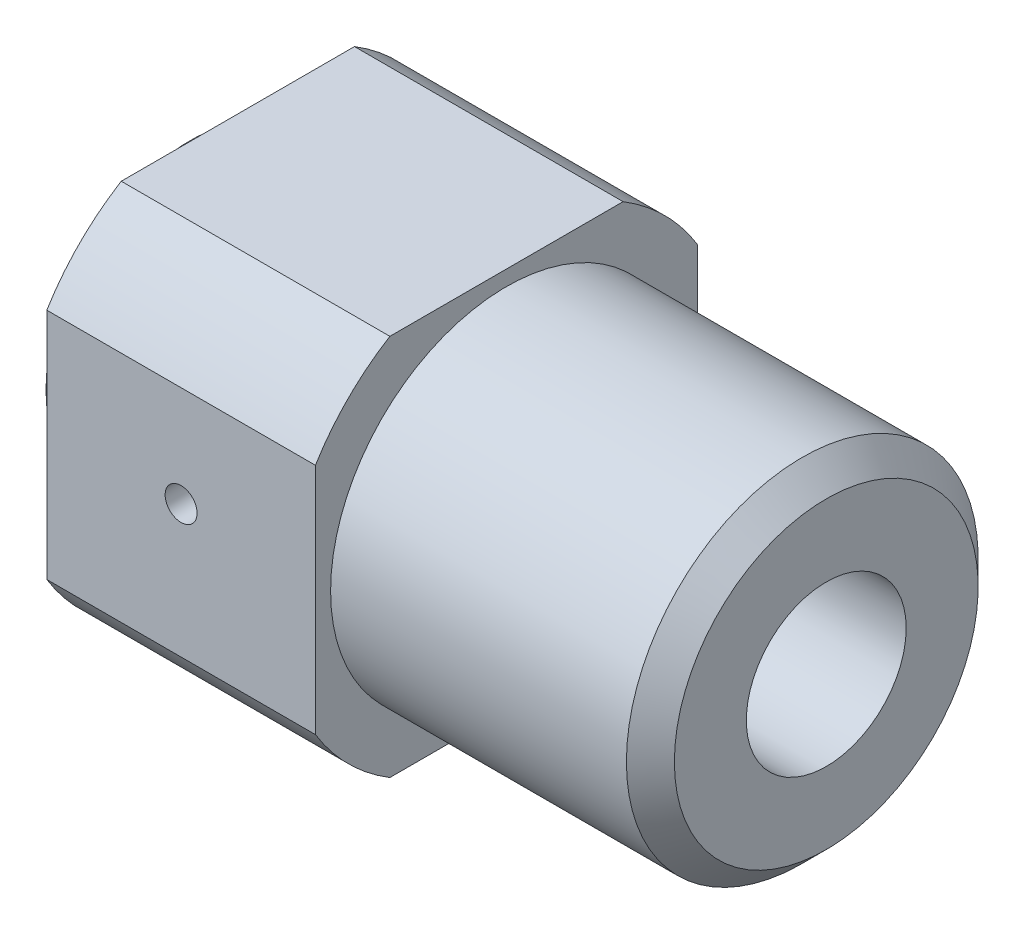
from build123d import *

# Parameters (mm, degrees)
CROQUIS2_OUTSIDE_W      = 40.812
CROQUIS2_OUTSIDE_H      = 40.812
CROQUIS2_OUTSIDE_W_2    = 23.9
CROQUIS2_OUTSIDE_H_2    = 23.9
CORTAR_EXTRUIR1_DEPTH   = 42.788036566
CROQUIS4_R              = 5
CORTAR_EXTRUIR2_DEPTH   = 41.494999691
CROQUIS3_R              = 1
CORTAR_EXTRUIR3_DEPTH   = 13
CROQUIS5_R              = 9
CROQUIS5_R_2            = 5
SALIENTE_EXTRUIR1_DEPTH = 3


with BuildPart() as part:
    # Croquis1 → Revolución1 (revolve)
    with BuildSketch(Plane(origin=(0, 0, 0), x_dir=(1, 0, 0), z_dir=(0, 1, 0)), mode=Mode.PRIVATE) as revoluci_n1_sk:
        Polygon((0, 0), (36.8, 0), (36.8, 9.5), (35.3, 11), (16.8, 11), (16.8, 14), (0, 14), align=None)
    revolve(revoluci_n1_sk.sketch.rotate(Axis((0, 0, 0), (1, 0, 0)), 180), axis=Axis((0, 0, 0), (1, 0, 0)))

    # Croquis2 outside → Cortar-Extruir1 (cut, through all)
    with BuildSketch(Plane(origin=(0, 0, 0), x_dir=(0, 0, -1), z_dir=(1, 0, 0))):
        Rectangle(CROQUIS2_OUTSIDE_W, CROQUIS2_OUTSIDE_H)
        Rectangle(CROQUIS2_OUTSIDE_W_2, CROQUIS2_OUTSIDE_H_2, mode=Mode.SUBTRACT)
    extrude(amount=CORTAR_EXTRUIR1_DEPTH, mode=Mode.SUBTRACT)

    # Croquis4 → Cortar-Extruir2 (cut, through all)
    with BuildSketch(Plane(origin=(36.8, 0, 0), x_dir=(0, 0, -1), z_dir=(1, 0, 0))):
        Circle(CROQUIS4_R)
    extrude(amount=-CORTAR_EXTRUIR2_DEPTH, mode=Mode.SUBTRACT)

    # Croquis3 → Cortar-Extruir3 (cut)
    with BuildSketch(Plane.XY.offset(11.95)):
        with Locations((8.4, 0.993661632)):
            Circle(CROQUIS3_R)
    extrude(amount=-CORTAR_EXTRUIR3_DEPTH, mode=Mode.SUBTRACT)

    # Croquis5 → Saliente-Extruir1 (add)
    with BuildSketch(Plane.ZY):
        with Locations(Location((0, 0, 0), (0, 0, 180))):
            Circle(CROQUIS5_R)
        with Locations(Location((0, 0, 0), (0, 0, 180))):
            Circle(CROQUIS5_R_2, mode=Mode.SUBTRACT)
    extrude(amount=SALIENTE_EXTRUIR1_DEPTH)


solid = part.part
